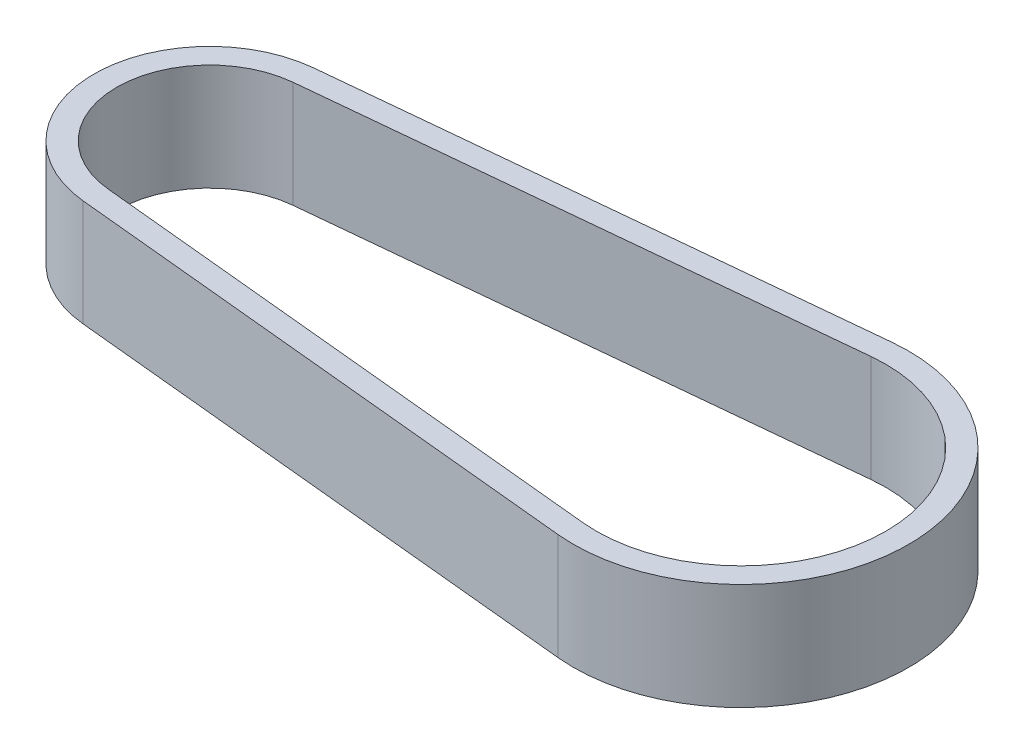
from build123d import *

# Parameters (mm, degrees)
BOSS_EXTRUDE1_DEPTH = 7


with BuildPart() as part:
    # Sketch1 → Boss-Extrude1 (new body)
    with BuildSketch(Plane(origin=(0, 0, 0), x_dir=(1, 0, 0), z_dir=(0, 1, 0))):
        with BuildLine():
            Line((-0.740401146, 7.563848633), (33.828366762, 10.947675653))
            ThreePointArc((33.828366762, 10.947675653), (45.9, 0), (33.828366762, -10.947675653))
            Line((33.828366762, -10.947675653), (-0.740401146, -7.563848633))
            ThreePointArc((-0.740401146, -7.563848633), (-7.6, 0), (-0.740401146, 7.563848633))
        make_face()
        with BuildLine():
            Line((-0.594269341, 6.070983771), (33.974498567, 9.454810791))
            ThreePointArc((33.974498567, 9.454810791), (44.4, 0), (33.974498567, -9.454810791))
            Line((33.974498567, -9.454810791), (-0.594269341, -6.070983771))
            ThreePointArc((-0.594269341, -6.070983771), (-6.1, 0), (-0.594269341, 6.070983771))
        make_face(mode=Mode.SUBTRACT)
    extrude(amount=BOSS_EXTRUDE1_DEPTH)


solid = part.part
